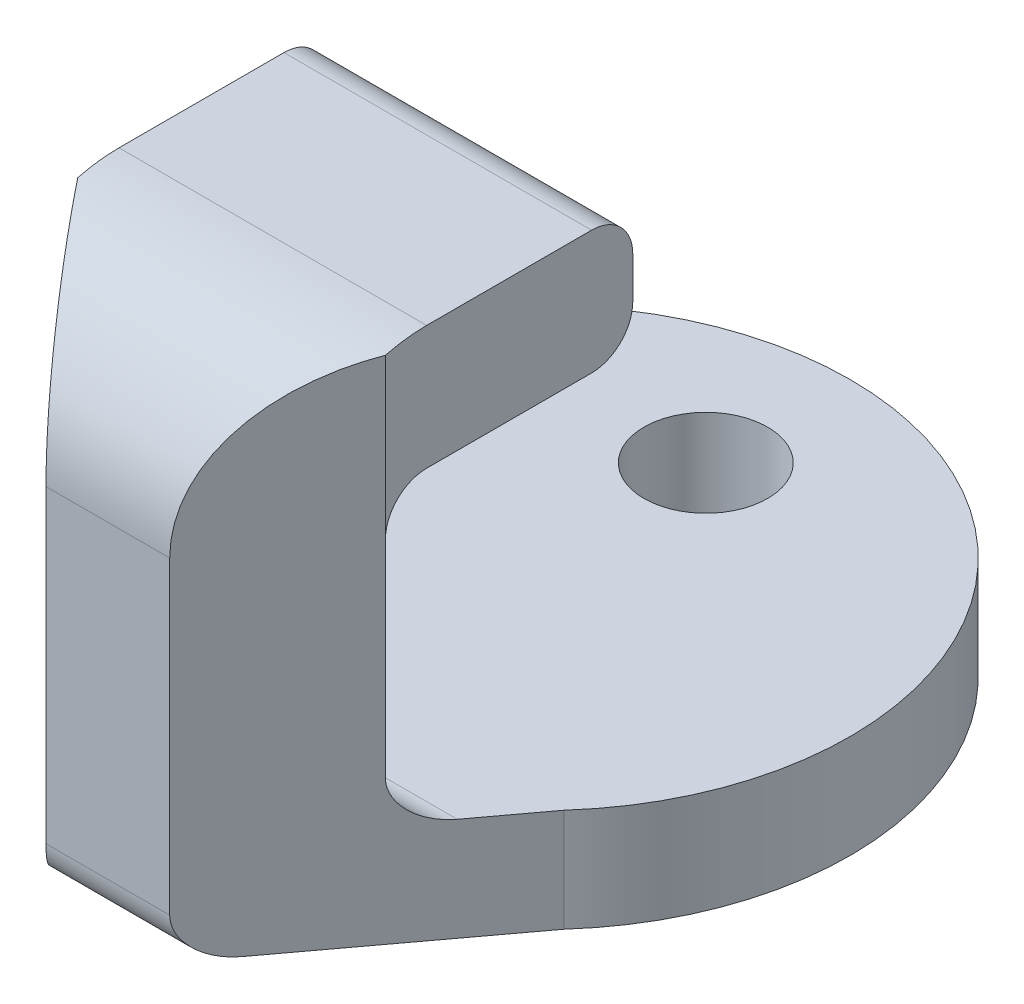
from build123d import *

# Parameters (mm, degrees)
SKETCH1_R           = 3
BOSS_EXTRUDE2_DEPTH = 5
SKETCH2_W           = 6
SKETCH2_H           = 6
BOSS_EXTRUDE5_DEPTH = 20
SKETCH6_W           = 14.919898766
SKETCH6_H           = 6
BOSS_EXTRUDE6_DEPTH = 12
FILLET2_R           = 8
FILLET3_R           = 2
FILLET4_R           = 2
FILLET5_R           = 2
FILLET6_R           = 2


with BuildPart() as part:
    # Sketch1 → Boss-Extrude2 (new body)
    with BuildSketch(Plane(origin=(0, 0, 0), x_dir=(1, 0, 0), z_dir=(0, 1, 0))):
        with BuildLine():
            ThreePointArc((11.158287634, -10.024600595), (0, 15), (-11.158287634, -10.024600595))
            Line((-11.158287634, -10.024600595), (-3, -21))
            Line((-3, -21), (3, -21))
            Line((3, -21), (11.158287634, -10.024600595))
        make_face()
        with Locations(Location((0, 8, 0), (0, 0, 270))):
            Circle(SKETCH1_R, mode=Mode.SUBTRACT)
    extrude(amount=BOSS_EXTRUDE2_DEPTH)

    # Sketch2 → Boss-Extrude5 (add)
    with BuildSketch(Plane(origin=(0, 5, 0), x_dir=(1, 0, 0), z_dir=(0, 1, 0))):
        Polygon((-7.459949383, -15), (-3, -21), (-3, -15), align=None)
        with Locations((0, -18)):
            Rectangle(SKETCH2_W, SKETCH2_H)
        Polygon((3, -15), (3, -21), (7.459949383, -15), align=None)
    extrude(amount=BOSS_EXTRUDE5_DEPTH)

    # Sketch6 → Boss-Extrude6 (add)
    with BuildSketch(Plane(origin=(0, 0, 15), x_dir=(-1, 0, 0), z_dir=(0, 0, -1))):
        with Locations((0, 22)):
            Rectangle(SKETCH6_W, SKETCH6_H)
    extrude(amount=BOSS_EXTRUDE6_DEPTH)

    # Fillet2
    fillet2_edges = [part.edges().sort_by_distance(p)[0] for p in [
        (0, 25, 21),
    ]]
    fillet(fillet2_edges, radius=FILLET2_R)

    # Fillet3
    fillet3_edges = [part.edges().sort_by_distance(p)[0] for p in [
        (0, 5, 15),
    ]]
    fillet(fillet3_edges, radius=FILLET3_R)

    # Fillet4
    fillet4_edges = [part.edges().sort_by_distance(p)[0] for p in [
        (0, 19, 15),
    ]]
    fillet(fillet4_edges, radius=FILLET4_R)

    # Fillet5
    fillet5_edges = [part.edges().sort_by_distance(p)[0] for p in [
        (0, 0, 21),
    ]]
    fillet(fillet5_edges, radius=FILLET5_R)

    # Fillet6
    fillet6_edges = [part.edges().sort_by_distance(p)[0] for p in [
        (0, 19, 3),
        (0, 25, 3),
    ]]
    fillet(fillet6_edges, radius=FILLET6_R)


solid = part.part
